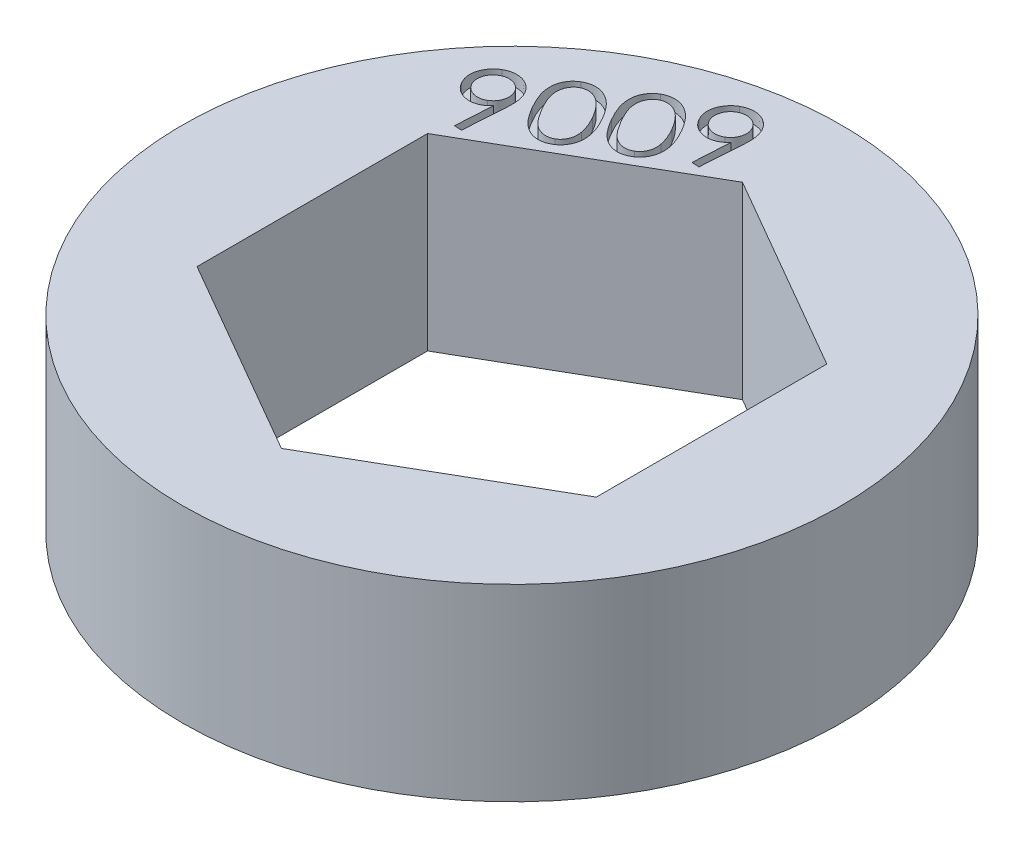
from build123d import *

# Parameters (mm, degrees)
SKETCH1_R           = 11.1125
BOSS_EXTRUDE1_DEPTH = 6.35
CUT_EXTRUDE1_DEPTH  = 0.4


with BuildPart() as part:
    # Sketch1 → Boss-Extrude1 (new body)
    with BuildSketch(Plane(origin=(0, 0, 0), x_dir=(1, 0, 0), z_dir=(0, 1, 0))):
        with Locations(Location((0, 0, 0), (0, 0, 270))):
            Circle(SKETCH1_R)
        Polygon((0, 7.772289324), (-6.731, 3.886144662), (-6.731, -3.886144662), (0, -7.772289324), (6.731, -3.886144662), (6.731, 3.886144662), align=None, mode=Mode.SUBTRACT)
    extrude(amount=BOSS_EXTRUDE1_DEPTH)

    # Sketch2 → Cut-Extrude1 (cut)
    # profile 1 of 4: a face of its own
    with BuildSketch(Plane(origin=(0, 6.35, 0), x_dir=(1, 0, 0), z_dir=(0, 1, 0))):
        with BuildLine():
            Line((-6.256404187, 4.555321698), (-6.504196655, 4.567533236))
            Line((-6.504196655, 4.567533236), (-6.430927424, 5.810566089))
            add(Edge.make_bspline(
                [(-6.430927424, 5.810566089), (-6.44691344, 5.793137137), (-6.478009785, 5.759233964), (-6.528510502, 5.714517195), (-6.579080881, 5.674700341), (-6.614892867, 5.652844156), (-6.632417809, 5.642148621)],
                knots=[0, 0, 0, 0, 1.07557127, 2.092224476, 3.066411598, 4, 4, 4, 4], degree=3))
            add(Edge.make_bspline(
                [(-6.632417809, 5.642148621), (-6.654076342, 5.630330039), (-6.696928705, 5.606946452), (-6.764225218, 5.580231208), (-6.832354926, 5.560444921), (-6.90153465, 5.549060429), (-6.971375915, 5.54360143), (-7.042356689, 5.546330182), (-7.114063914, 5.556689559), (-7.185917137, 5.573963569), (-7.256181287, 5.597580141), (-7.323179649, 5.627710488), (-7.386121469, 5.663971274), (-7.444753434, 5.706468388), (-7.499588197, 5.754535009), (-7.550108076, 5.808670678), (-7.596212924, 5.869186184), (-7.623109439, 5.91293143), (-7.636816847, 5.935225544)],
                knots=[0, 0, 0, 0, 1.015135184, 2.008489705, 2.974464217, 3.930823522, 4.890110555, 5.854468119, 6.84900024, 7.868689235, 8.893387844, 9.896732215, 10.888539014, 11.878968029, 12.873598221, 13.886496971, 14.922884625, 16, 16, 16, 16], degree=3))
            add(Edge.make_bspline(
                [(-7.636816847, 5.935225544), (-7.653660322, 5.966705429), (-7.68679947, 6.028641379), (-7.720354298, 6.127246221), (-7.742211539, 6.226937407), (-7.748221663, 6.328037024), (-7.742185883, 6.428928577), (-7.72071775, 6.527961427), (-7.686255606, 6.624625179), (-7.638578284, 6.717590498), (-7.579244773, 6.804587228), (-7.510510236, 6.883681263), (-7.431204863, 6.952417441), (-7.372081115, 6.989554103), (-7.342213482, 7.008314486)],
                knots=[0, 0, 0, 0, 1.035324533, 2.036977218, 3.013660684, 3.991039457, 4.968418229, 5.940283026, 6.923354643, 7.941094773, 8.965736768, 9.974485588, 10.976767849, 12, 12, 12, 12], degree=3))
            add(Edge.make_bspline(
                [(-7.342213482, 7.008314486), (-7.311741849, 7.024618404), (-7.251481837, 7.056860663), (-7.154808926, 7.089679686), (-7.055451058, 7.109803752), (-6.954197885, 7.116795458), (-6.852836762, 7.111012216), (-6.75392928, 7.090844152), (-6.658010638, 7.05758602), (-6.567353009, 7.010014232), (-6.482435474, 6.952350639), (-6.406074984, 6.88490464), (-6.339517124, 6.807946318), (-6.303524254, 6.750678792), (-6.285406591, 6.721852147)],
                knots=[0, 0, 0, 0, 1.019400264, 2.015942902, 3.002372847, 4.006779929, 5.005536382, 5.991966327, 6.979044859, 7.994053264, 9.007032045, 10.004279611, 10.995418019, 12, 12, 12, 12], degree=3))
            add(Edge.make_bspline(
                [(-6.285406591, 6.721852147), (-6.2729116, 6.698494561), (-6.247483595, 6.65096057), (-6.217212559, 6.57415427), (-6.192964273, 6.491851996), (-6.177242168, 6.419330212), (-6.167985013, 6.357662882), (-6.162160664, 6.307450586), (-6.159120662, 6.253766026), (-6.156169872, 6.196619896), (-6.155978399, 6.136200684), (-6.156985411, 6.072248576), (-6.159500549, 6.004896183), (-6.162345496, 5.958795342), (-6.16380002, 5.935225544)],
                knots=[0, 0, 0, 0, 1.179517641, 2.400384276, 3.669978525, 4.99951221, 5.702757638, 6.447991837, 7.250775919, 8.098000084, 8.997311831, 9.942054579, 10.947842213, 12, 12, 12, 12], degree=3))
            Line((-6.16380002, 5.935225544), (-6.256404187, 4.555321698))
        make_face()
        with BuildLine():
            add(Edge.make_bspline(
                [(-6.692966687, 5.86399157), (-6.677318219, 5.873514286), (-6.646585779, 5.892216201), (-6.604755998, 5.925292716), (-6.566640479, 5.960806918), (-6.533590728, 6.000378261), (-6.504385525, 6.042764562), (-6.479441127, 6.088315673), (-6.458256975, 6.136911552), (-6.442536052, 6.188383944), (-6.43048855, 6.240887193), (-6.424727662, 6.293616967), (-6.422789592, 6.345555328), (-6.426910947, 6.396947472), (-6.436874882, 6.447280893), (-6.451023488, 6.497177256), (-6.471008525, 6.546221951), (-6.487957963, 6.577665023), (-6.496564444, 6.593630993)],
                knots=[0, 0, 0, 0, 1.045108442, 2.052516081, 3.039037663, 4.014948609, 4.990090363, 5.974041511, 6.976128051, 8.011453109, 9.043011603, 10.047295345, 11.035574291, 12.007150616, 12.98344593, 13.961229243, 14.964765542, 16, 16, 16, 16], degree=3))
            add(Edge.make_bspline(
                [(-6.496564444, 6.593630993), (-6.505920083, 6.609105228), (-6.524410716, 6.639688751), (-6.557192886, 6.681323366), (-6.593052641, 6.718932962), (-6.632414642, 6.752022652), (-6.674852498, 6.781146302), (-6.720252599, 6.80626887), (-6.769110608, 6.82665478), (-6.82042226, 6.842644051), (-6.873001407, 6.854337565), (-6.92562539, 6.861207278), (-6.977646255, 6.86211004), (-7.028932695, 6.858009758), (-7.079660809, 6.848960947), (-7.129617318, 6.833813445), (-7.179326965, 6.814314), (-7.21077852, 6.796847138), (-7.226712681, 6.78799798)],
                knots=[0, 0, 0, 0, 1.031712043, 2.039092063, 3.018573684, 3.994457873, 4.969572892, 5.953497063, 6.951758218, 7.98705489, 9.018585102, 10.024008046, 11.012022604, 11.983572292, 12.958061913, 13.947831088, 14.960318852, 16, 16, 16, 16], degree=3))
            add(Edge.make_bspline(
                [(-7.226712681, 6.78799798), (-7.242219228, 6.778681569), (-7.272752137, 6.760337246), (-7.313928189, 6.727018745), (-7.352050804, 6.691721973), (-7.385027314, 6.652092421), (-7.414375776, 6.609881247), (-7.438599281, 6.564028807), (-7.459936662, 6.515609076), (-7.475605763, 6.464108393), (-7.487667576, 6.411612729), (-7.493404877, 6.359049818), (-7.495361088, 6.307282684), (-7.491238933, 6.256059632), (-7.481278862, 6.205726305), (-7.467129213, 6.155829917), (-7.447144459, 6.106785228), (-7.430194983, 6.075342155), (-7.421588482, 6.059376185)],
                knots=[0, 0, 0, 0, 1.034021631, 2.036022986, 3.024725885, 4.002794686, 4.980092595, 5.961574923, 6.965877195, 8.00349148, 9.037330872, 10.043835206, 11.024597356, 11.998321951, 12.97677597, 13.956721278, 14.962476515, 16, 16, 16, 16], degree=3))
            add(Edge.make_bspline(
                [(-7.421588482, 6.059376185), (-7.412233249, 6.043901333), (-7.393743417, 6.01331659), (-7.360955396, 5.971690875), (-7.325117148, 5.934048567), (-7.285782782, 5.901169594), (-7.243767703, 5.87165952), (-7.198266281, 5.846891918), (-7.149690532, 5.825677474), (-7.098212543, 5.809964973), (-7.045710797, 5.79791521), (-6.992980632, 5.792154909), (-6.941042373, 5.790216687), (-6.889650202, 5.794338081), (-6.839316788, 5.804302006), (-6.789420424, 5.818450615), (-6.740375729, 5.838435652), (-6.708932657, 5.855385089), (-6.692966687, 5.86399157)],
                knots=[0, 0, 0, 0, 1.033571637, 2.042767394, 3.024014467, 4.001657624, 4.970548117, 5.956245748, 6.96011096, 7.997273687, 9.030663166, 10.03672948, 11.026762591, 12.000063433, 12.97809164, 13.957610489, 14.962928033, 16, 16, 16, 16], degree=3))
        make_face(mode=Mode.SUBTRACT)
    # profile 2 of 4: a face of its own
    with BuildSketch(Plane(origin=(0, 6.35, 0), x_dir=(1, 0, 0), z_dir=(0, 1, 0))):
        with BuildLine():
            add(Edge.make_bspline(
                [(-5.720858238, 6.403334518), (-5.740964385, 6.43863889), (-5.780067902, 6.507300735), (-5.832704923, 6.609708238), (-5.87982305, 6.707239528), (-5.920120868, 6.800406962), (-5.953966297, 6.888963535), (-5.980935768, 6.97309231), (-6.002309155, 7.052622861), (-6.016559385, 7.128356521), (-6.025290709, 7.200790964), (-6.029272597, 7.270463691), (-6.029527111, 7.33793433), (-6.024942128, 7.403237185), (-6.015876838, 7.466359177), (-6.002103729, 7.527278745), (-5.983646998, 7.585890183), (-5.961291261, 7.642382922), (-5.93512355, 7.696381732), (-5.904020194, 7.746743803), (-5.870849006, 7.794851281), (-5.833291907, 7.839050827), (-5.793043944, 7.880810704), (-5.748580304, 7.918633708), (-5.701224689, 7.954226943), (-5.667279139, 7.974830571), (-5.650133078, 7.985237563)],
                knots=[0, 0, 0, 0, 1.642217524, 3.193873097, 4.653599743, 6.020219012, 7.296149585, 8.484364078, 9.590266645, 10.622995624, 11.596731579, 12.537641419, 13.442669779, 14.322439731, 15.181528583, 16.018162769, 16.844365298, 17.663022962, 18.472528165, 19.266229043, 20.053716379, 20.832379209, 21.608138827, 22.395685855, 23.18965321, 24, 24, 24, 24], degree=3))
            add(Edge.make_bspline(
                [(-5.650133078, 7.985237563), (-5.632305439, 7.995039289), (-5.596962387, 8.014471078), (-5.541618535, 8.038102937), (-5.485876909, 8.058267197), (-5.428791744, 8.073048484), (-5.370933477, 8.08317212), (-5.311902627, 8.088825035), (-5.252019044, 8.089801444), (-5.191315063, 8.086140073), (-5.129983333, 8.078198437), (-5.068570055, 8.064361185), (-5.007348201, 8.045175741), (-4.945776671, 8.022046887), (-4.885095207, 7.992148489), (-4.824144113, 7.957793986), (-4.763014618, 7.918802915), (-4.702439601, 7.873595256), (-4.641174552, 7.822968018), (-4.580553853, 7.764951147), (-4.519665396, 7.699965565), (-4.459422605, 7.627767253), (-4.399367578, 7.548385978), (-4.338593485, 7.462519127), (-4.278880695, 7.368810674), (-4.240188498, 7.303371287), (-4.220365449, 7.269844935)],
                knots=[0, 0, 0, 0, 0.815881076, 1.617473213, 2.411751612, 3.192532544, 3.980223438, 4.766442947, 5.569622482, 6.380892254, 7.204795063, 8.048528362, 8.903143009, 9.777765604, 10.684831081, 11.614241792, 12.584586996, 13.591843045, 14.645331516, 15.771781295, 16.956234458, 18.217113798, 19.542884518, 20.949560407, 22.437178076, 24, 24, 24, 24], degree=3))
            add(Edge.make_bspline(
                [(-4.220365449, 7.269844935), (-4.201361602, 7.236022707), (-4.164298498, 7.170059395), (-4.113065717, 7.071952234), (-4.069059292, 6.976849269), (-4.030428349, 6.885531159), (-3.998484046, 6.797687868), (-3.972136956, 6.71338251), (-3.952227354, 6.632504645), (-3.93822445, 6.554822802), (-3.930434138, 6.479978596), (-3.925802224, 6.407970546), (-3.927231427, 6.338291547), (-3.931810635, 6.270895893), (-3.942322475, 6.205847886), (-3.956337768, 6.143005375), (-3.975205459, 6.082740988), (-3.998772669, 6.025175379), (-4.026014657, 5.970311044), (-4.057505796, 5.918771637), (-4.091315803, 5.869766766), (-4.129083833, 5.824098477), (-4.171278413, 5.782582204), (-4.215818525, 5.743274721), (-4.26402504, 5.707149787), (-4.298534362, 5.68629755), (-4.316022501, 5.675730352)],
                knots=[0, 0, 0, 0, 1.558572261, 3.039675171, 4.44500239, 5.767404933, 7.021920233, 8.19867626, 9.314183841, 10.366093107, 11.366862767, 12.335955634, 13.262731656, 14.164729598, 15.047477431, 15.907015182, 16.749641984, 17.580952634, 18.403702246, 19.207672054, 20.005351578, 20.794016824, 21.584181799, 22.380929523, 23.179510693, 24, 24, 24, 24], degree=3))
            add(Edge.make_bspline(
                [(-4.316022501, 5.675730352), (-4.333538764, 5.666165956), (-4.368318898, 5.647174978), (-4.422255515, 5.623060886), (-4.477591524, 5.604481487), (-4.533396232, 5.589331129), (-4.590353867, 5.579972393), (-4.647969947, 5.57413433), (-4.706667555, 5.573278177), (-4.766084932, 5.576617931), (-4.825726019, 5.585611727), (-4.885470341, 5.598450135), (-4.944593106, 5.617845625), (-5.003880701, 5.641142976), (-5.062975416, 5.669872103), (-5.122031764, 5.703406611), (-5.180626314, 5.742451711), (-5.239663467, 5.78626478), (-5.298316831, 5.83711167), (-5.357638207, 5.895010691), (-5.417490029, 5.960538024), (-5.477426702, 6.034175043), (-5.538146143, 6.115234958), (-5.598752605, 6.204331186), (-5.660749692, 6.300636689), (-5.700418169, 6.368411853), (-5.720858238, 6.403334518)],
                knots=[0, 0, 0, 0, 0.807491903, 1.603348545, 2.386916451, 3.167713854, 3.940658363, 4.719915701, 5.50935356, 6.313835313, 7.125313705, 7.947948844, 8.783651521, 9.640150085, 10.524255013, 11.440287308, 12.386399569, 13.372019105, 14.413529699, 15.525036669, 16.724996316, 18.002813491, 19.365932914, 20.822335035, 22.362637201, 24, 24, 24, 24], degree=3))
        make_face()
        with BuildLine():
            add(Edge.make_bspline(
                [(-5.510718014, 6.51883532), (-5.493257379, 6.488877918), (-5.459445962, 6.430867298), (-5.407393631, 6.34830941), (-5.356510711, 6.27257149), (-5.307400223, 6.203186547), (-5.259142473, 6.140934509), (-5.211689997, 6.085967366), (-5.165987769, 6.037249661), (-5.120895705, 5.995146532), (-5.076066922, 5.958600684), (-5.031258261, 5.926386646), (-4.985980027, 5.89843744), (-4.940637791, 5.874354577), (-4.894865216, 5.854363985), (-4.848903987, 5.83788248), (-4.802282591, 5.826401968), (-4.74122454, 5.815466481), (-4.666246578, 5.811279468), (-4.579608581, 5.819934857), (-4.497619111, 5.841321191), (-4.44810505, 5.866622729), (-4.423382276, 5.879255993)],
                knots=[0, 0, 0, 0, 1.475228016, 2.856686104, 4.15161897, 5.357081144, 6.47289893, 7.501387829, 8.445726694, 9.313720896, 10.124066195, 10.905058304, 11.660046733, 12.386348828, 13.08755313, 13.783651734, 14.460982071, 15.127735434, 16.421461315, 17.639985157, 18.821625413, 20, 20, 20, 20], degree=3))
            add(Edge.make_bspline(
                [(-4.423382276, 5.879255993), (-4.399880995, 5.894410214), (-4.353144381, 5.924547165), (-4.293309415, 5.984277604), (-4.243303316, 6.054177503), (-4.209870865, 6.119956127), (-4.18924523, 6.177064836), (-4.176213129, 6.222354334), (-4.167859318, 6.269941398), (-4.162545271, 6.319249386), (-4.161991208, 6.370449391), (-4.163726397, 6.423491689), (-4.169972227, 6.47838756), (-4.176729958, 6.515309334), (-4.180169135, 6.534099743)],
                knots=[0, 0, 0, 0, 1.342886321, 2.670576022, 4.038999414, 5.466462105, 6.205051725, 6.959707281, 7.731476591, 8.527516338, 9.344012544, 10.193626534, 11.080691652, 12, 12, 12, 12], degree=3))
            add(Edge.make_bspline(
                [(-4.180169135, 6.534099743), (-4.184972413, 6.557911184), (-4.194748203, 6.606373014), (-4.215072528, 6.67907599), (-4.238961931, 6.753665377), (-4.267345986, 6.829553466), (-4.300342128, 6.906775091), (-4.336844401, 6.985669885), (-4.378063674, 7.066145508), (-4.408422537, 7.119517592), (-4.42389109, 7.146711922)],
                knots=[0, 0, 0, 0, 0.879876913, 1.790754508, 2.73331625, 3.717259664, 4.725112015, 5.77538776, 6.866507818, 8, 8, 8, 8], degree=3))
            add(Edge.make_bspline(
                [(-4.42389109, 7.146711922), (-4.43962457, 7.173637773), (-4.470408496, 7.22632055), (-4.519002356, 7.301300162), (-4.56664388, 7.371924537), (-4.614964674, 7.4371718), (-4.663866644, 7.496967407), (-4.712116409, 7.552398338), (-4.760995046, 7.602213443), (-4.809952492, 7.647179327), (-4.858795544, 7.687303769), (-4.906962743, 7.723175317), (-4.955252178, 7.753808548), (-5.002987247, 7.780538031), (-5.050713958, 7.80226639), (-5.097898099, 7.81993368), (-5.144901545, 7.832780061), (-5.206157979, 7.843222788), (-5.280690122, 7.84752115), (-5.366754924, 7.839672501), (-5.447951774, 7.818086056), (-5.497006333, 7.793113925), (-5.52140311, 7.780694294)],
                knots=[0, 0, 0, 0, 1.327522451, 2.597413504, 3.803087542, 4.954092809, 6.052504639, 7.091116491, 8.08170511, 9.022070092, 9.919800897, 10.771882377, 11.577119672, 12.352806521, 13.099205072, 13.807429758, 14.495830891, 15.170113202, 16.450227669, 17.661618134, 18.837030004, 20, 20, 20, 20], degree=3))
            add(Edge.make_bspline(
                [(-5.52140311, 7.780694294), (-5.544939029, 7.765571604), (-5.591845033, 7.735432777), (-5.651389499, 7.674944309), (-5.702423035, 7.604650094), (-5.735434243, 7.537605277), (-5.757395294, 7.480035001), (-5.769181998, 7.434019241), (-5.778566118, 7.386498062), (-5.784275879, 7.336983388), (-5.785327553, 7.285619651), (-5.784226243, 7.232559584), (-5.778043606, 7.177927446), (-5.76969692, 7.120899033), (-5.756168973, 7.060690409), (-5.737147307, 6.99650654), (-5.71242381, 6.927895957), (-5.682923542, 6.854485407), (-5.647677582, 6.776877216), (-5.607192497, 6.694638238), (-5.561658217, 6.607779982), (-5.528043428, 6.549086537), (-5.510718014, 6.51883532)],
                knots=[0, 0, 0, 0, 1.186584607, 2.364808541, 3.584028067, 4.867913378, 5.52979883, 6.201670858, 6.884946004, 7.589109066, 8.317961587, 9.068444384, 9.84432244, 10.65432116, 11.518850237, 12.466086659, 13.499587148, 14.619373863, 15.830028341, 17.123623296, 18.517485242, 20, 20, 20, 20], degree=3))
        make_face(mode=Mode.SUBTRACT)
    # profile 3 of 4: a face of its own
    with BuildSketch(Plane(origin=(0, 6.35, 0), x_dir=(1, 0, 0), z_dir=(0, 1, 0))):
        with BuildLine():
            add(Edge.make_bspline(
                [(-4.028777834, 7.380257595), (-4.04888398, 7.415561967), (-4.087987497, 7.484223812), (-4.140624519, 7.586631315), (-4.187742645, 7.684162605), (-4.228040464, 7.777330039), (-4.261885893, 7.865886612), (-4.288855363, 7.950015387), (-4.31022875, 8.029545938), (-4.324478981, 8.105279598), (-4.333210304, 8.177714041), (-4.337192193, 8.247386768), (-4.337446706, 8.314857407), (-4.332861724, 8.380160261), (-4.323796434, 8.443282254), (-4.310023324, 8.504201822), (-4.291566594, 8.56281326), (-4.269210857, 8.619305999), (-4.243043146, 8.673304809), (-4.211939789, 8.72366688), (-4.178768602, 8.771774358), (-4.141211503, 8.815973904), (-4.100963539, 8.857733781), (-4.0564999, 8.895556785), (-4.009144285, 8.93115002), (-3.975198734, 8.951753648), (-3.958052673, 8.96216064)],
                knots=[0, 0, 0, 0, 1.642217524, 3.193873097, 4.653599743, 6.020219012, 7.296149585, 8.484364078, 9.590266645, 10.622995624, 11.596731579, 12.537641419, 13.442669779, 14.322439731, 15.181528583, 16.018162769, 16.844365298, 17.663022962, 18.472528165, 19.266229043, 20.053716379, 20.832379209, 21.608138827, 22.395685855, 23.18965321, 24, 24, 24, 24], degree=3))
            add(Edge.make_bspline(
                [(-3.958052673, 8.96216064), (-3.940225035, 8.971962366), (-3.904881983, 8.991394155), (-3.84953813, 9.015026014), (-3.793796505, 9.035190274), (-3.736711339, 9.049971561), (-3.678853073, 9.060095197), (-3.619822223, 9.065748112), (-3.55993864, 9.066724521), (-3.499234659, 9.06306315), (-3.437902929, 9.055121514), (-3.37648965, 9.041284262), (-3.315267796, 9.022098818), (-3.253696267, 8.998969964), (-3.193014803, 8.969071566), (-3.132063709, 8.934717063), (-3.070934214, 8.895725991), (-3.010359197, 8.850518333), (-2.949094148, 8.799891095), (-2.888473449, 8.741874224), (-2.827584992, 8.676888642), (-2.7673422, 8.604690329), (-2.707287174, 8.525309055), (-2.646513081, 8.439442204), (-2.586800291, 8.345733751), (-2.548108094, 8.280294363), (-2.528285045, 8.246768012)],
                knots=[0, 0, 0, 0, 0.815881076, 1.617473213, 2.411751612, 3.192532544, 3.980223438, 4.766442947, 5.569622482, 6.380892254, 7.204795063, 8.048528362, 8.903143009, 9.777765604, 10.684831081, 11.614241792, 12.584586996, 13.591843045, 14.645331516, 15.771781295, 16.956234458, 18.217113798, 19.542884518, 20.949560407, 22.437178076, 24, 24, 24, 24], degree=3))
            add(Edge.make_bspline(
                [(-2.528285045, 8.246768012), (-2.509281197, 8.212945783), (-2.472218094, 8.146982471), (-2.420985313, 8.048875311), (-2.376978888, 7.953772346), (-2.338347945, 7.862454236), (-2.306403642, 7.774610945), (-2.280056551, 7.690305587), (-2.260146949, 7.609427722), (-2.246144045, 7.531745879), (-2.238353733, 7.456901673), (-2.23372182, 7.384893623), (-2.235151022, 7.315214624), (-2.239730231, 7.247818969), (-2.250242071, 7.182770963), (-2.264257364, 7.119928452), (-2.283125055, 7.059664064), (-2.306692265, 7.002098456), (-2.333934253, 6.94723412), (-2.365425392, 6.895694714), (-2.399235398, 6.846689843), (-2.437003429, 6.801021554), (-2.479198009, 6.759505281), (-2.523738121, 6.720197798), (-2.571944635, 6.684072864), (-2.606453957, 6.663220627), (-2.623942096, 6.652653429)],
                knots=[0, 0, 0, 0, 1.558572261, 3.039675171, 4.44500239, 5.767404933, 7.021920233, 8.19867626, 9.314183841, 10.366093107, 11.366862767, 12.335955634, 13.262731656, 14.164729598, 15.047477431, 15.907015182, 16.749641984, 17.580952634, 18.403702246, 19.207672054, 20.005351578, 20.794016824, 21.584181799, 22.380929523, 23.179510693, 24, 24, 24, 24], degree=3))
            add(Edge.make_bspline(
                [(-2.623942096, 6.652653429), (-2.64145836, 6.643089032), (-2.676238493, 6.624098055), (-2.730175111, 6.599983963), (-2.78551112, 6.581404564), (-2.841315827, 6.566254206), (-2.898273462, 6.55689547), (-2.955889543, 6.551057407), (-3.014587151, 6.550201254), (-3.074004527, 6.553541008), (-3.133645615, 6.562534803), (-3.193389936, 6.575373212), (-3.252512702, 6.594768702), (-3.311800296, 6.618066053), (-3.370895011, 6.64679518), (-3.429951359, 6.680329688), (-3.48854591, 6.719374788), (-3.547583063, 6.763187857), (-3.606236427, 6.814034747), (-3.665557802, 6.871933768), (-3.725409624, 6.937461101), (-3.785346298, 7.01109812), (-3.846065738, 7.092158035), (-3.9066722, 7.181254263), (-3.968669287, 7.277559766), (-4.008337765, 7.34533493), (-4.028777834, 7.380257595)],
                knots=[0, 0, 0, 0, 0.807491903, 1.603348545, 2.386916451, 3.167713854, 3.940658363, 4.719915701, 5.50935356, 6.313835313, 7.125313705, 7.947948844, 8.783651521, 9.640150085, 10.524255013, 11.440287308, 12.386399569, 13.372019105, 14.413529699, 15.525036669, 16.724996316, 18.002813491, 19.365932914, 20.822335035, 22.362637201, 24, 24, 24, 24], degree=3))
        make_face()
        with BuildLine():
            add(Edge.make_bspline(
                [(-3.818637609, 7.495758397), (-3.801176975, 7.465800995), (-3.767365557, 7.407790375), (-3.715313227, 7.325232487), (-3.664430307, 7.249494567), (-3.615319818, 7.180109624), (-3.567062069, 7.117857585), (-3.519609592, 7.062890443), (-3.473907365, 7.014172738), (-3.428815301, 6.972069609), (-3.383986518, 6.935523761), (-3.339177857, 6.903309723), (-3.293899622, 6.875360517), (-3.248557387, 6.851277654), (-3.202784812, 6.831287062), (-3.156823583, 6.814805557), (-3.110202187, 6.803325045), (-3.049144135, 6.792389558), (-2.974166174, 6.788202545), (-2.887528177, 6.796857934), (-2.805538707, 6.818244268), (-2.756024645, 6.843545806), (-2.731301872, 6.85617907)],
                knots=[0, 0, 0, 0, 1.475228016, 2.856686104, 4.15161897, 5.357081144, 6.47289893, 7.501387829, 8.445726694, 9.313720896, 10.124066195, 10.905058304, 11.660046733, 12.386348828, 13.08755313, 13.783651734, 14.460982071, 15.127735434, 16.421461315, 17.639985157, 18.821625413, 20, 20, 20, 20], degree=3))
            add(Edge.make_bspline(
                [(-2.731301872, 6.85617907), (-2.70780059, 6.871333291), (-2.661063977, 6.901470242), (-2.60122901, 6.961200681), (-2.551222911, 7.03110058), (-2.51779046, 7.096879204), (-2.497164826, 7.153987913), (-2.484132724, 7.199277411), (-2.475778913, 7.246864475), (-2.470464866, 7.296172463), (-2.469910803, 7.347372468), (-2.471645993, 7.400414766), (-2.477891822, 7.455310637), (-2.484649554, 7.492232411), (-2.488088731, 7.51102282)],
                knots=[0, 0, 0, 0, 1.342886321, 2.670576022, 4.038999414, 5.466462105, 6.205051725, 6.959707281, 7.731476591, 8.527516338, 9.344012544, 10.193626534, 11.080691652, 12, 12, 12, 12], degree=3))
            add(Edge.make_bspline(
                [(-2.488088731, 7.51102282), (-2.492892009, 7.534834261), (-2.502667798, 7.583296091), (-2.522992123, 7.655999067), (-2.546881527, 7.730588453), (-2.575265581, 7.806476543), (-2.608261724, 7.883698168), (-2.644763997, 7.962592962), (-2.68598327, 8.043068585), (-2.716342133, 8.096440669), (-2.731810686, 8.123634999)],
                knots=[0, 0, 0, 0, 0.879876913, 1.790754508, 2.73331625, 3.717259664, 4.725112015, 5.77538776, 6.866507818, 8, 8, 8, 8], degree=3))
            add(Edge.make_bspline(
                [(-2.731810686, 8.123634999), (-2.747544166, 8.15056085), (-2.778328091, 8.203243627), (-2.826921952, 8.278223238), (-2.874563476, 8.348847614), (-2.92288427, 8.414094877), (-2.971786239, 8.473890484), (-3.020036005, 8.529321415), (-3.068914642, 8.57913652), (-3.117872088, 8.624102404), (-3.16671514, 8.664226846), (-3.214882338, 8.700098394), (-3.263171774, 8.730731625), (-3.310906843, 8.757461108), (-3.358633554, 8.779189467), (-3.405817695, 8.796856757), (-3.452821141, 8.809703138), (-3.514077575, 8.820145865), (-3.588609717, 8.824444227), (-3.674674519, 8.816595578), (-3.75587137, 8.795009133), (-3.804925929, 8.770037002), (-3.829322705, 8.757617371)],
                knots=[0, 0, 0, 0, 1.327522451, 2.597413504, 3.803087542, 4.954092809, 6.052504639, 7.091116491, 8.08170511, 9.022070092, 9.919800897, 10.771882377, 11.577119672, 12.352806521, 13.099205072, 13.807429758, 14.495830891, 15.170113202, 16.450227669, 17.661618134, 18.837030004, 20, 20, 20, 20], degree=3))
            add(Edge.make_bspline(
                [(-3.829322705, 8.757617371), (-3.852858624, 8.74249468), (-3.899764628, 8.712355854), (-3.959309095, 8.651867386), (-4.010342631, 8.581573171), (-4.043353839, 8.514528354), (-4.06531489, 8.456958078), (-4.077101593, 8.410942318), (-4.086485713, 8.363421139), (-4.092195475, 8.313906464), (-4.093247148, 8.262542728), (-4.092145839, 8.20948266), (-4.085963202, 8.154850523), (-4.077616516, 8.097822109), (-4.064088569, 8.037613486), (-4.045066903, 7.973429617), (-4.020343405, 7.904819034), (-3.990843138, 7.831408484), (-3.955597178, 7.753800293), (-3.915112093, 7.671561315), (-3.869577812, 7.584703059), (-3.835963024, 7.526009614), (-3.818637609, 7.495758397)],
                knots=[0, 0, 0, 0, 1.186584607, 2.364808541, 3.584028067, 4.867913378, 5.52979883, 6.201670858, 6.884946004, 7.589109066, 8.317961587, 9.068444384, 9.84432244, 10.65432116, 11.518850237, 12.466086659, 13.499587148, 14.619373863, 15.830028341, 17.123623296, 18.517485242, 20, 20, 20, 20], degree=3))
        make_face(mode=Mode.SUBTRACT)
    # profile 4 of 4: a face of its own
    with BuildSketch(Plane(origin=(0, 6.35, 0), x_dir=(1, 0, 0), z_dir=(0, 1, 0))):
        with BuildLine():
            Line((-1.180162974, 7.486090929), (-1.427955442, 7.498302467))
            Line((-1.427955442, 7.498302467), (-1.354686211, 8.74133532))
            add(Edge.make_bspline(
                [(-1.354686211, 8.74133532), (-1.370672228, 8.723906368), (-1.401768572, 8.690003195), (-1.452269289, 8.645286426), (-1.502839668, 8.605469572), (-1.538651654, 8.583613387), (-1.556176596, 8.572917852)],
                knots=[0, 0, 0, 0, 1.07557127, 2.092224476, 3.066411598, 4, 4, 4, 4], degree=3))
            add(Edge.make_bspline(
                [(-1.556176596, 8.572917852), (-1.577835129, 8.561099269), (-1.620687492, 8.537715683), (-1.687984005, 8.511000438), (-1.756113713, 8.491214152), (-1.825293437, 8.47982966), (-1.895134702, 8.474370661), (-1.966115476, 8.477099413), (-2.037822701, 8.48745879), (-2.109675924, 8.5047328), (-2.179940074, 8.528349372), (-2.246938436, 8.558479718), (-2.309880256, 8.594740504), (-2.368512221, 8.637237618), (-2.423346984, 8.685304239), (-2.473866864, 8.739439909), (-2.519971711, 8.799955415), (-2.546868226, 8.843700661), (-2.560575634, 8.865994775)],
                knots=[0, 0, 0, 0, 1.015135184, 2.008489705, 2.974464217, 3.930823522, 4.890110555, 5.854468119, 6.84900024, 7.868689235, 8.893387844, 9.896732215, 10.888539014, 11.878968029, 12.873598221, 13.886496971, 14.922884625, 16, 16, 16, 16], degree=3))
            add(Edge.make_bspline(
                [(-2.560575634, 8.865994775), (-2.577419109, 8.89747466), (-2.610558257, 8.959410609), (-2.644113085, 9.058015452), (-2.665970327, 9.157706638), (-2.67198045, 9.258806255), (-2.66594467, 9.359697808), (-2.644476537, 9.458730658), (-2.610014393, 9.55539441), (-2.562337071, 9.648359729), (-2.50300356, 9.735356459), (-2.434269023, 9.814450493), (-2.35496365, 9.883186672), (-2.295839902, 9.920323334), (-2.265972269, 9.939083717)],
                knots=[0, 0, 0, 0, 1.035324533, 2.036977218, 3.013660684, 3.991039457, 4.968418229, 5.940283026, 6.923354643, 7.941094773, 8.965736768, 9.974485588, 10.976767849, 12, 12, 12, 12], degree=3))
            add(Edge.make_bspline(
                [(-2.265972269, 9.939083717), (-2.235500636, 9.955387635), (-2.175240624, 9.987629894), (-2.078567713, 10.020448917), (-1.979209845, 10.040572983), (-1.877956672, 10.047564688), (-1.776595549, 10.041781447), (-1.677688067, 10.021613382), (-1.581769425, 9.98835525), (-1.491111797, 9.940783462), (-1.406194261, 9.88311987), (-1.329833771, 9.815673871), (-1.263275912, 9.738715549), (-1.227283041, 9.681448023), (-1.209165378, 9.652621377)],
                knots=[0, 0, 0, 0, 1.019400264, 2.015942902, 3.002372847, 4.006779929, 5.005536382, 5.991966327, 6.979044859, 7.994053264, 9.007032045, 10.004279611, 10.995418019, 12, 12, 12, 12], degree=3))
            add(Edge.make_bspline(
                [(-1.209165378, 9.652621377), (-1.196670387, 9.629263792), (-1.171242382, 9.581729801), (-1.140971346, 9.504923501), (-1.11672306, 9.422621227), (-1.101000955, 9.350099442), (-1.0917438, 9.288432113), (-1.085919451, 9.238219817), (-1.082879449, 9.184535257), (-1.079928659, 9.127389127), (-1.079737186, 9.066969915), (-1.080744198, 9.003017807), (-1.083259337, 8.935665414), (-1.086104283, 8.889564573), (-1.087558808, 8.865994775)],
                knots=[0, 0, 0, 0, 1.179517641, 2.400384276, 3.669978525, 4.99951221, 5.702757638, 6.447991837, 7.250775919, 8.098000084, 8.997311831, 9.942054579, 10.947842213, 12, 12, 12, 12], degree=3))
            Line((-1.087558808, 8.865994775), (-1.180162974, 7.486090929))
        make_face()
        with BuildLine():
            add(Edge.make_bspline(
                [(-1.616725474, 8.794760801), (-1.601077006, 8.804283517), (-1.570344566, 8.822985432), (-1.528514785, 8.856061947), (-1.490399266, 8.891576148), (-1.457349515, 8.931147492), (-1.428144312, 8.973533793), (-1.403199914, 9.019084904), (-1.382015762, 9.067680783), (-1.366294839, 9.119153175), (-1.354247337, 9.171656424), (-1.348486449, 9.224386198), (-1.346548379, 9.276324558), (-1.350669734, 9.327716703), (-1.360633669, 9.378050124), (-1.374782275, 9.427946487), (-1.394767313, 9.476991182), (-1.41171675, 9.508434254), (-1.420323231, 9.524400224)],
                knots=[0, 0, 0, 0, 1.045108442, 2.052516081, 3.039037663, 4.014948609, 4.990090363, 5.974041511, 6.976128051, 8.011453109, 9.043011603, 10.047295345, 11.035574291, 12.007150616, 12.98344593, 13.961229243, 14.964765542, 16, 16, 16, 16], degree=3))
            add(Edge.make_bspline(
                [(-1.420323231, 9.524400224), (-1.42967887, 9.539874458), (-1.448169503, 9.570457982), (-1.480951673, 9.612092597), (-1.516811428, 9.649702193), (-1.556173429, 9.682791882), (-1.598611286, 9.711915533), (-1.644011386, 9.7370381), (-1.692869395, 9.75742401), (-1.744181047, 9.773413282), (-1.796760194, 9.785106796), (-1.849384177, 9.791976509), (-1.901405042, 9.792879271), (-1.952691482, 9.788778989), (-2.003419596, 9.779730178), (-2.053376105, 9.764582676), (-2.103085752, 9.74508323), (-2.134537307, 9.727616369), (-2.150471468, 9.718767211)],
                knots=[0, 0, 0, 0, 1.031712043, 2.039092063, 3.018573684, 3.994457873, 4.969572892, 5.953497063, 6.951758218, 7.98705489, 9.018585102, 10.024008046, 11.012022604, 11.983572292, 12.958061913, 13.947831088, 14.960318852, 16, 16, 16, 16], degree=3))
            add(Edge.make_bspline(
                [(-2.150471468, 9.718767211), (-2.165978015, 9.7094508), (-2.196510924, 9.691106477), (-2.237686976, 9.657787975), (-2.275809591, 9.622491204), (-2.308786101, 9.582861652), (-2.338134563, 9.540650477), (-2.362358068, 9.494798038), (-2.383695449, 9.446378307), (-2.39936455, 9.394877623), (-2.411426363, 9.34238196), (-2.417163664, 9.289819049), (-2.419119875, 9.238051915), (-2.41499772, 9.186828863), (-2.405037649, 9.136495535), (-2.390888, 9.086599148), (-2.370903246, 9.037554459), (-2.35395377, 9.006111386), (-2.345347269, 8.990145416)],
                knots=[0, 0, 0, 0, 1.034021631, 2.036022986, 3.024725885, 4.002794686, 4.980092595, 5.961574923, 6.965877195, 8.00349148, 9.037330872, 10.043835206, 11.024597356, 11.998321951, 12.97677597, 13.956721278, 14.962476515, 16, 16, 16, 16], degree=3))
            add(Edge.make_bspline(
                [(-2.345347269, 8.990145416), (-2.335992036, 8.974670564), (-2.317502204, 8.944085821), (-2.284714183, 8.902460106), (-2.248875935, 8.864817798), (-2.209541569, 8.831938825), (-2.16752649, 8.802428751), (-2.122025068, 8.777661149), (-2.073449319, 8.756446705), (-2.02197133, 8.740734204), (-1.969469584, 8.728684441), (-1.916739419, 8.72292414), (-1.86480116, 8.720985917), (-1.813408989, 8.725107312), (-1.763075575, 8.735071237), (-1.713179211, 8.749219846), (-1.664134516, 8.769204882), (-1.632691444, 8.78615432), (-1.616725474, 8.794760801)],
                knots=[0, 0, 0, 0, 1.033571637, 2.042767394, 3.024014467, 4.001657624, 4.970548117, 5.956245748, 6.96011096, 7.997273687, 9.030663166, 10.03672948, 11.026762591, 12.000063433, 12.97809164, 13.957610489, 14.962928033, 16, 16, 16, 16], degree=3))
        make_face(mode=Mode.SUBTRACT)
    extrude(amount=-CUT_EXTRUDE1_DEPTH, mode=Mode.SUBTRACT)


solid = part.part
